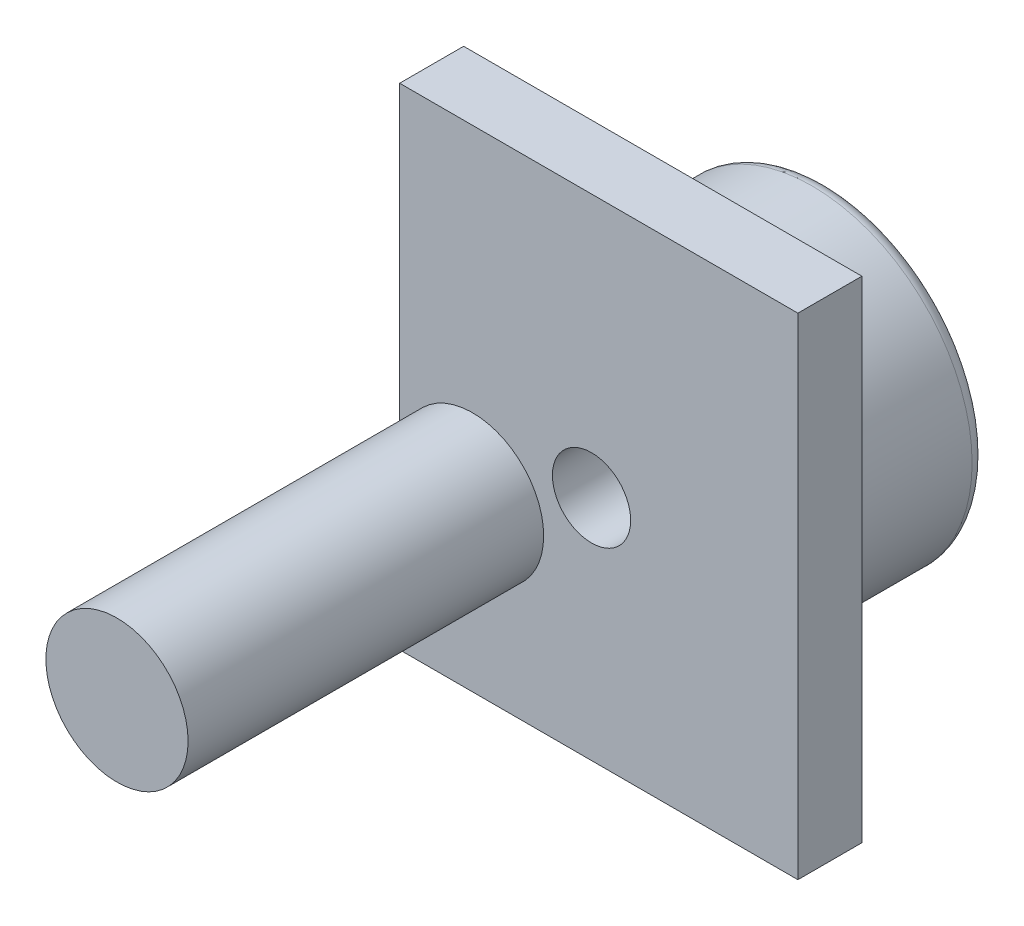
from build123d import *

# Parameters (mm, degrees)
SKETCH_1_R          = 4.5
EXTRUDE_1_DEPTH     = 4.8
SKETCH_2_W          = 11.2
SKETCH_2_H          = 13.8
EXTRUDE_2_DEPTH     = 1.8
FILLET_1_R          = 0.4
SKETCH_4_R          = 2
EXTRUDE_3_DEPTH     = 10
CUT_EXTRUDE_1_DEPTH = 4
SKETCH_7_R          = 1.1
CUT_EXTRUDE_2_DEPTH = 16.7213231


with BuildPart() as part:
    # Эскиз1 → Бобышка-Вытянуть1 (new body)
    with BuildSketch(Plane.XY):
        Circle(SKETCH_1_R)
    extrude(amount=EXTRUDE_1_DEPTH)

    # Эскиз2 → Бобышка-Вытянуть2 (add)
    with BuildSketch(Plane.XY.offset(4.8)):
        with Locations((0.2, 0.5)):
            Rectangle(SKETCH_2_W, SKETCH_2_H)
    extrude(amount=EXTRUDE_2_DEPTH)

    # Скругление1
    fillet_1_edges = [part.edges().sort_by_distance(p)[0] for p in [
        (-4.5, 0, 0),
    ]]
    fillet(fillet_1_edges, radius=FILLET_1_R)

    # Эскиз4 → Бобышка-Вытянуть3 (add)
    with BuildSketch(Plane.XY.offset(6.6)):
        with Locations((-3.35, -1.6)):
            Circle(SKETCH_4_R)
    extrude(amount=EXTRUDE_3_DEPTH)

    # Эскиз3 → Вырез-Вытянуть1 (cut)
    with BuildSketch(Plane(origin=(0, 0, 0), x_dir=(-1, 0, 0), z_dir=(0, 0, -1))):
        Polygon((-3, -1.73), (3, -1.73), (0, 3.466152423), align=None)
    extrude(amount=-CUT_EXTRUDE_1_DEPTH, mode=Mode.SUBTRACT)

    # Эскиз7 → Вырез-Вытянуть2 (cut, through all)
    with BuildSketch(Plane(origin=(0, 0, 4), x_dir=(-1, 0, 0), z_dir=(0, 0, -1))):
        with Locations((0.003552103, 0)):
            Circle(SKETCH_7_R)
    extrude(amount=-CUT_EXTRUDE_2_DEPTH, mode=Mode.SUBTRACT)


solid = part.part
